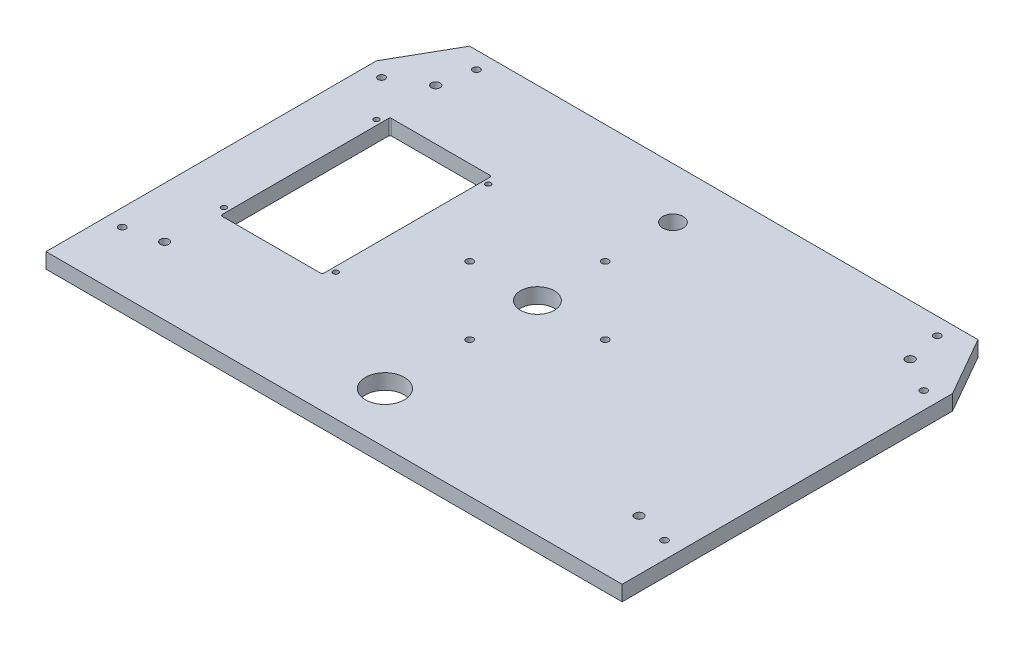
from build123d import *

# Parameters (mm, degrees)
ESQUISSE3_R             = 2.55
STRUCTURE_DEPTH         = 9
ESQUISSE4_R             = 10
ESQUISSE4_R_2           = 11.5
ESQUISSE4_R_3           = 2.05
ESQUISSE4_R_4           = 6
ENL_V_MAT_EXTRU_1_DEPTH = 10
ESQUISSE5_OUTSIDE_W     = 424.118
ESQUISSE5_OUTSIDE_H     = 314.118
ESQUISSE5_OUTSIDE_R     = 2.55
ESQUISSE5_OUTSIDE_R_2   = 2.05
ENL_V_MAT_EXTRU_2_DEPTH = 10
ESQUISSE6_R             = 1.55
ENL_V_MAT_EXTRU_3_DEPTH = 209.281060109


with BuildPart() as part:
    # Esquisse3 → structure (new body)
    with BuildSketch(Plane(origin=(0, 0, 0), x_dir=(1, 0, 0), z_dir=(0, 1, 0))):
        Polygon((-170, 0), (-170, -120), (170, -120), (170, 0), (170, 75), (150, 110), (-150, 110), (-170, 75), align=None)
        with Locations(Location((-140, -80, 0), (0, 0, 270))):
            Circle(ESQUISSE3_R, mode=Mode.SUBTRACT)
        with Locations(Location((-140, 80, 0), (0, 0, 270))):
            Circle(ESQUISSE3_R, mode=Mode.SUBTRACT)
        with Locations(Location((140, -80, 0), (0, 0, 270))):
            Circle(ESQUISSE3_R, mode=Mode.SUBTRACT)
        with Locations(Location((140, 80, 0), (0, 0, 270))):
            Circle(ESQUISSE3_R, mode=Mode.SUBTRACT)
    extrude(amount=-STRUCTURE_DEPTH)

    # Esquisse4 → Enlèv. mat.-Extru.1 (cut)
    with BuildSketch(Plane(origin=(0, 0, 0), x_dir=(1, 0, 0), z_dir=(0, 1, 0))):
        with Locations(Location((0, 0, 0), (0, 0, 270))):
            Circle(ESQUISSE4_R)
        with Locations(Location((0, -90, 0), (0, 0, 270))):
            Circle(ESQUISSE4_R_2)
        with Locations(Location((0, 40, 0), (0, 0, 270))):
            Circle(ESQUISSE4_R_3)
        with Locations(Location((40, 0, 0), (0, 0, 270))):
            Circle(ESQUISSE4_R_3)
        with Locations(Location((0, -40, 0), (0, 0, 270))):
            Circle(ESQUISSE4_R_3)
        with Locations(Location((-40, 0, 0), (0, 0, 270))):
            Circle(ESQUISSE4_R_3)
        with Locations(Location((0, 80, 0), (0, 0, 270))):
            Circle(ESQUISSE4_R_4)
    extrude(amount=-ENL_V_MAT_EXTRU_1_DEPTH, mode=Mode.SUBTRACT)

    # Esquisse5 outside → Enlèv. mat.-Extru.2 (cut)
    # profile 1 of 9: a face of its own
    with BuildSketch(Plane(origin=(0, 0, 0), x_dir=(1, 0, 0), z_dir=(0, 1, 0))):
        with Locations((0, -5)):
            Rectangle(ESQUISSE5_OUTSIDE_W, ESQUISSE5_OUTSIDE_H)
        Polygon((-170, 75), (-170, -120), (170, -120), (170, 75), (150, 110), (-150, 110), align=None, mode=Mode.SUBTRACT)
    # profile 2 of 9: a face of its own
    with BuildSketch(Plane(origin=(0, 0, 0), x_dir=(1, 0, 0), z_dir=(0, 1, 0))):
        with Locations(Location((-140, 80, 0), (0, 0, 270))):
            Circle(ESQUISSE5_OUTSIDE_R)
    # profile 3 of 9: a face of its own
    with BuildSketch(Plane(origin=(0, 0, 0), x_dir=(1, 0, 0), z_dir=(0, 1, 0))):
        with Locations(Location((-140, -80, 0), (0, 0, 270))):
            Circle(ESQUISSE5_OUTSIDE_R)
    # profile 4 of 9: a face of its own
    with BuildSketch(Plane(origin=(0, 0, 0), x_dir=(1, 0, 0), z_dir=(0, 1, 0))):
        with Locations(Location((-136, 100, 0), (0, 0, 270))):
            Circle(ESQUISSE5_OUTSIDE_R_2)
    # profile 5 of 9: a face of its own
    with BuildSketch(Plane(origin=(0, 0, 0), x_dir=(1, 0, 0), z_dir=(0, 1, 0))):
        with Locations(Location((-160, 68, 0), (0, 0, 270))):
            Circle(ESQUISSE5_OUTSIDE_R_2)
    # profile 6 of 9: a face of its own
    with BuildSketch(Plane(origin=(0, 0, 0), x_dir=(1, 0, 0), z_dir=(0, 1, 0))):
        with Locations(Location((-160, -85, 0), (0, 0, 270))):
            Circle(ESQUISSE5_OUTSIDE_R_2)
    # profile 7 of 9: a face of its own
    with BuildSketch(Plane(origin=(0, 0, 0), x_dir=(1, 0, 0), z_dir=(0, 1, 0))):
        with Locations(Location((160, -85, 0), (0, 0, 270))):
            Circle(ESQUISSE5_OUTSIDE_R_2)
    # profile 8 of 9: a face of its own
    with BuildSketch(Plane(origin=(0, 0, 0), x_dir=(1, 0, 0), z_dir=(0, 1, 0))):
        with Locations(Location((160, 68, 0), (0, 0, 270))):
            Circle(ESQUISSE5_OUTSIDE_R_2)
    # profile 9 of 9: a face of its own
    with BuildSketch(Plane(origin=(0, 0, 0), x_dir=(1, 0, 0), z_dir=(0, 1, 0))):
        with Locations(Location((136, 100, 0), (0, 0, 270))):
            Circle(ESQUISSE5_OUTSIDE_R_2)
    extrude(amount=-ENL_V_MAT_EXTRU_2_DEPTH, mode=Mode.SUBTRACT)

    # Esquisse6 → Enlèv. mat.-Extru.3 (cut, through all)
    with BuildSketch(Plane(origin=(0, 0, 0), x_dir=(1, 0, 0), z_dir=(0, 1, 0))):
        with Locations(Location((-140, 45, 0), (0, 0, 270))):
            Circle(ESQUISSE6_R)
        with Locations(Location((-74, 45, 0), (0, 0, 270))):
            Circle(ESQUISSE6_R)
        with Locations(Location((-140, -45, 0), (0, 0, 270))):
            Circle(ESQUISSE6_R)
        with Locations(Location((-74, -45, 0), (0, 0, 270))):
            Circle(ESQUISSE6_R)
        with BuildLine():
            Line((-78, -50), (-136, -50))
            ThreePointArc((-136, -50), (-136.707106781, -49.707106781), (-137, -49))
            Line((-137, -49), (-137, 49))
            ThreePointArc((-137, 49), (-136.707106781, 49.707106781), (-136, 50))
            Line((-136, 50), (-78, 50))
            ThreePointArc((-78, 50), (-77.292893219, 49.707106781), (-77, 49))
            Line((-77, 49), (-77, -49))
            ThreePointArc((-77, -49), (-77.292893219, -49.707106781), (-78, -50))
        make_face()
    extrude(amount=-ENL_V_MAT_EXTRU_3_DEPTH, mode=Mode.SUBTRACT)


solid = part.part
